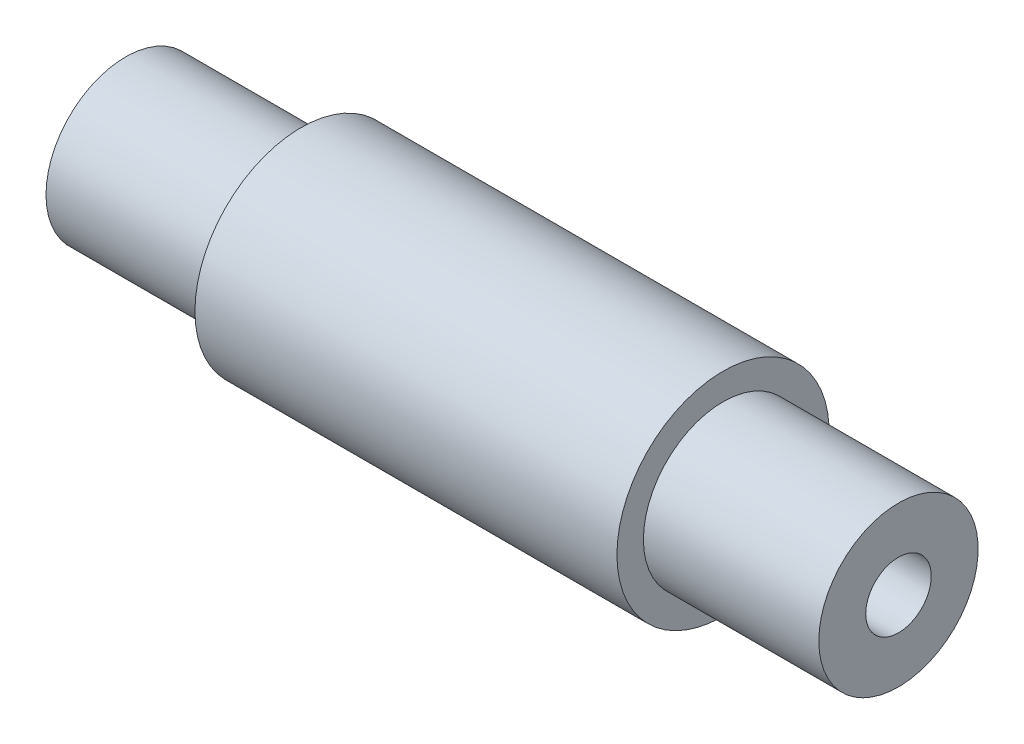
from build123d import *

# Parameters (mm, degrees)
SOCKET_1_SKETCH_W = 16.2
SOCKET_1_SKETCH_H = 3.175
SOCKET_2_SKETCH_W = 16.2
SOCKET_2_SKETCH_H = 3.175


with BuildPart() as part:
    # Filter_F2 Sketch → Filter_F2 (revolve)
    with BuildSketch(Plane.XY):
        Polygon((-37.45, 0), (-37.45, 7.722), (-20.45, 7.722), (-20.45, 10.287), (20.45, 10.287), (20.45, 7.722), (37.45, 7.722), (37.45, 0), align=None)
    revolve(axis=Axis((-1000, 0, 0), (1, 0, 0)))

    # Socket 1 Sketch → Socket 1 (revolve, cut)
    with BuildSketch(Plane.XY):
        with Locations((-30.35, 1.5875)):
            Rectangle(SOCKET_1_SKETCH_W, SOCKET_1_SKETCH_H)
    revolve(axis=Axis((-1000, 0, 0), (1, 0, 0)), mode=Mode.SUBTRACT)

    # Socket 2 Sketch → Socket 2 (revolve, cut)
    with BuildSketch(Plane.XY):
        with Locations((30.35, 1.5875)):
            Rectangle(SOCKET_2_SKETCH_W, SOCKET_2_SKETCH_H)
    revolve(axis=Axis((-1000, 0, 0), (1, 0, 0)), mode=Mode.SUBTRACT)


solid = part.part
